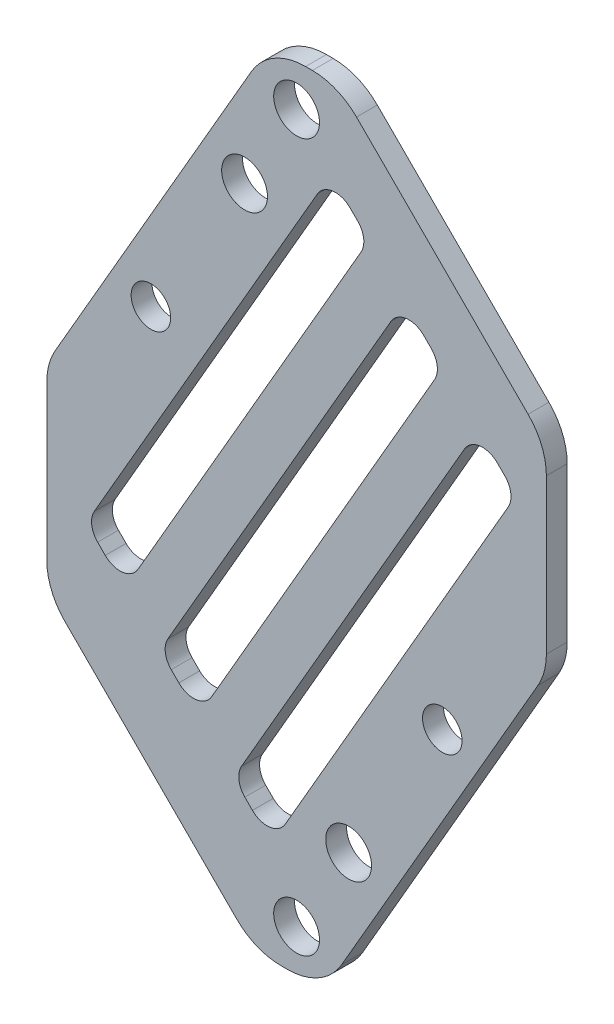
from build123d import *

# Parameters (mm, degrees)
SKETCH_1_W           = 200
SKETCH_1_H           = 380
EXTRUDE_1_DEPTH      = 10
SKETCH_2_R           = 11
CUT_EXTRUDE_1_DEPTH  = 430.534631898
SKETCH_3_R           = 8
CUT_EXTRUDE_2_DEPTH  = 430.534631898
SKETCH_4_R           = 9.5
CUT_EXTRUDE_3_DEPTH  = 6
CUT_EXTRUDE_START    = -6
SKETCH_5_R           = 9.5
CUT_EXTRUDE_4_DEPTH  = 6
SKETCH_6_R           = 11
CUT_EXTRUDE_5_DEPTH  = 430.534631898
SKETCH_7_R           = 8
CUT_EXTRUDE_6_DEPTH  = 430.534631898
SKETCH_8_R           = 9.5
CUT_EXTRUDE_7_DEPTH  = 6
SKETCH_9_R           = 9.5
CUT_EXTRUDE_8_DEPTH  = 6
SKETCH_10_W          = 40
SKETCH_10_H          = 380
EXTRUDE_3_DEPTH      = 10
CUT_EXTRUDE_9_DEPTH  = 450.55533586
CHAMFER_1_SIZE       = 100
FILLET_1_R           = 30
CUT_EXTRUDE_10_DEPTH = 450.55533586


with BuildPart() as part:
    # 草图1 → 凸台-拉伸1 (new body)
    with BuildSketch(Plane.XY):
        with Locations((100, 190)):
            Rectangle(SKETCH_1_W, SKETCH_1_H)
    extrude(amount=EXTRUDE_1_DEPTH)

    # 草图2 → 切除-拉伸1 (cut, through all)
    with BuildSketch(Plane.XY.offset(10)):
        with Locations((120, 20)):
            Circle(SKETCH_2_R)
        with Locations((145, 63.301270189)):
            Circle(SKETCH_2_R)
    extrude(amount=-CUT_EXTRUDE_1_DEPTH, mode=Mode.SUBTRACT)

    # 草图3 → 切除-拉伸2 (cut, through all)
    with BuildSketch(Plane.XY.offset(10)):
        with Locations((50, 243)):
            Circle(SKETCH_3_R)
    extrude(amount=-CUT_EXTRUDE_2_DEPTH, mode=Mode.SUBTRACT)

    # 草图4 → 切除-拉伸3 (cut)
    with BuildSketch(Plane.XY.offset(10)):
        with Locations((50, 243)):
            Circle(SKETCH_4_R)
    extrude(amount=-CUT_EXTRUDE_3_DEPTH, mode=Mode.SUBTRACT)

    # 草图5 → 切除-拉伸4 (cut)
    with BuildSketch(Plane(origin=(0, 0, 0), x_dir=(-1, 0, 0), z_dir=(0, 0, -1)).offset(CUT_EXTRUDE_START)):
        with Locations(Location((-50, 243, 0), (0, 0, 180))):
            Circle(SKETCH_5_R)
    extrude(amount=CUT_EXTRUDE_4_DEPTH, mode=Mode.SUBTRACT)

    # 草图6 → 切除-拉伸5 (cut, through all)
    with BuildSketch(Plane.XY.offset(10)):
        with Locations((95, 316.698729811)):
            Circle(SKETCH_6_R)
        with Locations((120, 360)):
            Circle(SKETCH_6_R)
    extrude(amount=-CUT_EXTRUDE_5_DEPTH, mode=Mode.SUBTRACT)

    # 草图7 → 切除-拉伸6 (cut, through all)
    with BuildSketch(Plane.XY.offset(10)):
        with Locations((190, 137)):
            Circle(SKETCH_7_R)
    extrude(amount=-CUT_EXTRUDE_6_DEPTH, mode=Mode.SUBTRACT)

    # 草图8 → 切除-拉伸7 (cut)
    with BuildSketch(Plane.XY.offset(10)):
        with Locations((190, 137)):
            Circle(SKETCH_8_R)
    extrude(amount=-CUT_EXTRUDE_7_DEPTH, mode=Mode.SUBTRACT)

    # 草图9 → 切除-拉伸8 (cut)
    with BuildSketch(Plane(origin=(0, 0, 0), x_dir=(-1, 0, 0), z_dir=(0, 0, -1)).offset(CUT_EXTRUDE_START)):
        with Locations(Location((-190, 137, 0), (0, 0, 180))):
            Circle(SKETCH_9_R)
    extrude(amount=CUT_EXTRUDE_8_DEPTH, mode=Mode.SUBTRACT)

    # 草图10 → 凸台-拉伸3 (add)
    with BuildSketch(Plane.XY.offset(10)):
        with Locations((220, 190)):
            Rectangle(SKETCH_10_W, SKETCH_10_H)
    extrude(amount=-EXTRUDE_3_DEPTH)

    # 草图11 → 切除-拉伸9 (cut, through all)
    with BuildSketch(Plane.XY.offset(10)):
        Polygon((240, 185.32943641), (133, 0), (240, 0), align=None)
        Polygon((0, 380), (0, 194.67056359), (107, 380), align=None)
    extrude(amount=-CUT_EXTRUDE_9_DEPTH, mode=Mode.SUBTRACT)

    # 倒角1
    chamfer_1_edges = [part.edges().sort_by_distance(p)[0] for p in [
        (240, 380, 5),
        (0, 0, 5),
    ]]
    chamfer(chamfer_1_edges, length=CHAMFER_1_SIZE)

    # 圆角1
    fillet_1_edges = [part.edges().sort_by_distance(p)[0] for p in [
        (240, 280, 5),
        (140, 380, 5),
        (100, 0, 5),
        (0, 100, 5),
        (240, 185.32943641, 5),
        (133, 0, 5),
        (107, 380, 5),
        (0, 194.67056359, 5),
    ]]
    fillet(fillet_1_edges, radius=FILLET_1_R)

    # 草图12 → 切除-拉伸10 (cut, through all)
    with BuildSketch(Plane.XY.offset(10)):
        with BuildLine():
            Line((28.082053888, 128.486488607), (24.42179985, 132.146742645))
            ThreePointArc((24.42179985, 132.146742645), (21.578419048, 137.912548534), (22.832613624, 144.217810457))
            Line((22.832613624, 144.217810457), (129.975855095, 329.795348372))
            ThreePointArc((129.975855095, 329.795348372), (137.330847211, 334.709796986), (145.707176945, 331.866416184))
            Line((145.707176945, 331.866416184), (149.367430983, 328.206162146))
            ThreePointArc((149.367430983, 328.206162146), (152.210811785, 322.440356256), (150.956617209, 316.135094334))
            Line((150.956617209, 316.135094334), (43.813375738, 130.557556419))
            ThreePointArc((43.813375738, 130.557556419), (36.458383622, 125.643107805), (28.082053888, 128.486488607))
        make_face()
        with BuildLine():
            Line((165.331194154, 294.440009313), (58.187952683, 108.862471397))
            ThreePointArc((58.187952683, 108.862471397), (56.933758108, 102.557209475), (59.777138909, 96.791403586))
            Line((59.777138909, 96.791403586), (63.437392947, 93.131149548))
            ThreePointArc((63.437392947, 93.131149548), (71.813722681, 90.287768746), (79.168714797, 95.20221736))
            Line((79.168714797, 95.20221736), (186.311956268, 280.779755275))
            ThreePointArc((186.311956268, 280.779755275), (187.566150844, 287.085017197), (184.722770042, 292.850823087))
            Line((184.722770042, 292.850823087), (181.062516004, 296.511077125))
            ThreePointArc((181.062516004, 296.511077125), (172.68618627, 299.354457927), (165.331194154, 294.440009313))
        make_face()
        with BuildLine():
            Line((200.686533214, 259.084670253), (93.543291743, 73.507132338))
            ThreePointArc((93.543291743, 73.507132338), (92.289097167, 67.201870416), (95.132477969, 61.436064526))
            Line((95.132477969, 61.436064526), (98.792732007, 57.775810488))
            ThreePointArc((98.792732007, 57.775810488), (107.169061741, 54.932429686), (114.524053856, 59.8468783))
            Line((114.524053856, 59.8468783), (221.667295327, 245.424416216))
            ThreePointArc((221.667295327, 245.424416216), (222.921489903, 251.729678138), (220.078109101, 257.495484027))
            Line((220.078109101, 257.495484027), (216.417855063, 261.155738065))
            ThreePointArc((216.417855063, 261.155738065), (208.041525329, 263.999118867), (200.686533214, 259.084670253))
        make_face()
    extrude(amount=-CUT_EXTRUDE_10_DEPTH, mode=Mode.SUBTRACT)


solid = part.part
